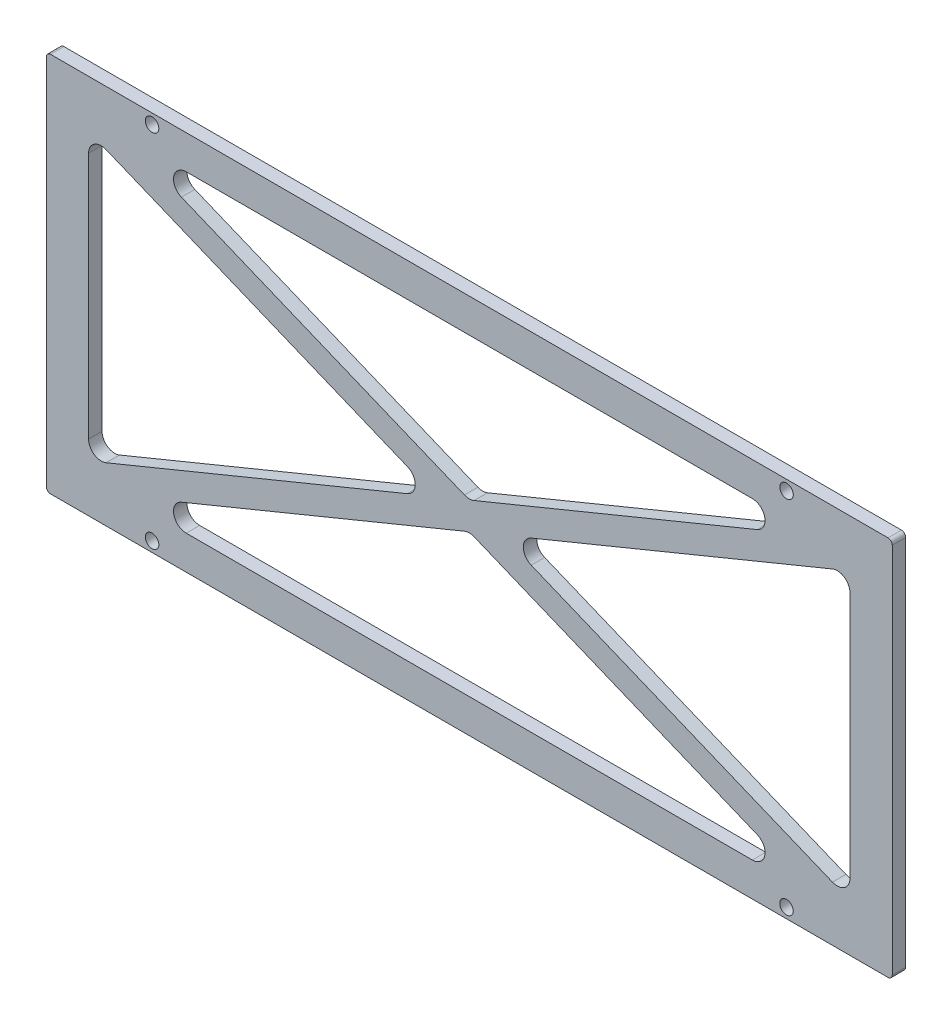
from build123d import *

# Parameters (mm, degrees)
SKETCH1_W            = 200
SKETCH1_H            = 90
BOSS_EXTRUDE1_DEPTH  = 3.175
CUT_EXTRUDE1_DEPTH   = 110.704515062
M3_CLEARANCE_HOLE1_D = 3.2
FILLET1_R            = 3
FILLET2_R            = 1


with BuildPart() as part:
    # Sketch1 → Boss-Extrude1 (new body)
    with BuildSketch(Plane.XY):
        Rectangle(SKETCH1_W, SKETCH1_H)
    extrude(amount=BOSS_EXTRUDE1_DEPTH)

    # Sketch2 → Cut-Extrude1 (cut, through all)
    with BuildSketch(Plane.XY.offset(3.175)):
        Polygon((-90, 33.756373771), (-90, -33.756373771), (-7.889901637, 0), align=None)
        Polygon((-82.110098363, 37), (0, 3.243626229), (82.110098363, 37), align=None)
        Polygon((90, 33.756373771), (7.889901637, 0), (90, -33.756373771), align=None)
        Polygon((-82.110098363, -37), (0, -3.243626229), (82.110098363, -37), align=None)
    extrude(amount=-CUT_EXTRUDE1_DEPTH, mode=Mode.SUBTRACT)

    # M3 Clearance Hole1 (through all)
    with Locations(Plane.XY.offset(3.175)):
        with Locations((-75, 42.61875), (75, 42.61875), (75, -42.61875), (-75, -42.61875)):
            Hole(M3_CLEARANCE_HOLE1_D / 2)

    # Fillet1
    fillet1_edges = [part.edges().sort_by_distance(p)[0] for p in [
        (-82.110098363, 37, 1.5875),
        (82.110098363, 37, 1.5875),
        (0, 3.243626229, 1.5875),
        (82.110098363, -37, 1.5875),
        (-82.110098363, -37, 1.5875),
        (0, -3.243626229, 1.5875),
        (90, 33.756373771, 1.5875),
        (90, -33.756373771, 1.5875),
        (7.889901637, 0, 1.5875),
        (-90, 33.756373771, 1.5875),
        (-7.889901637, 0, 1.5875),
        (-90, -33.756373771, 1.5875),
    ]]
    fillet(fillet1_edges, radius=FILLET1_R)

    # Fillet2
    fillet2_edges = [part.edges().sort_by_distance(p)[0] for p in [
        (100, -45, 1.5875),
        (-100, -45, 1.5875),
        (-100, 45, 1.5875),
        (100, 45, 1.5875),
    ]]
    fillet(fillet2_edges, radius=FILLET2_R)


solid = part.part
